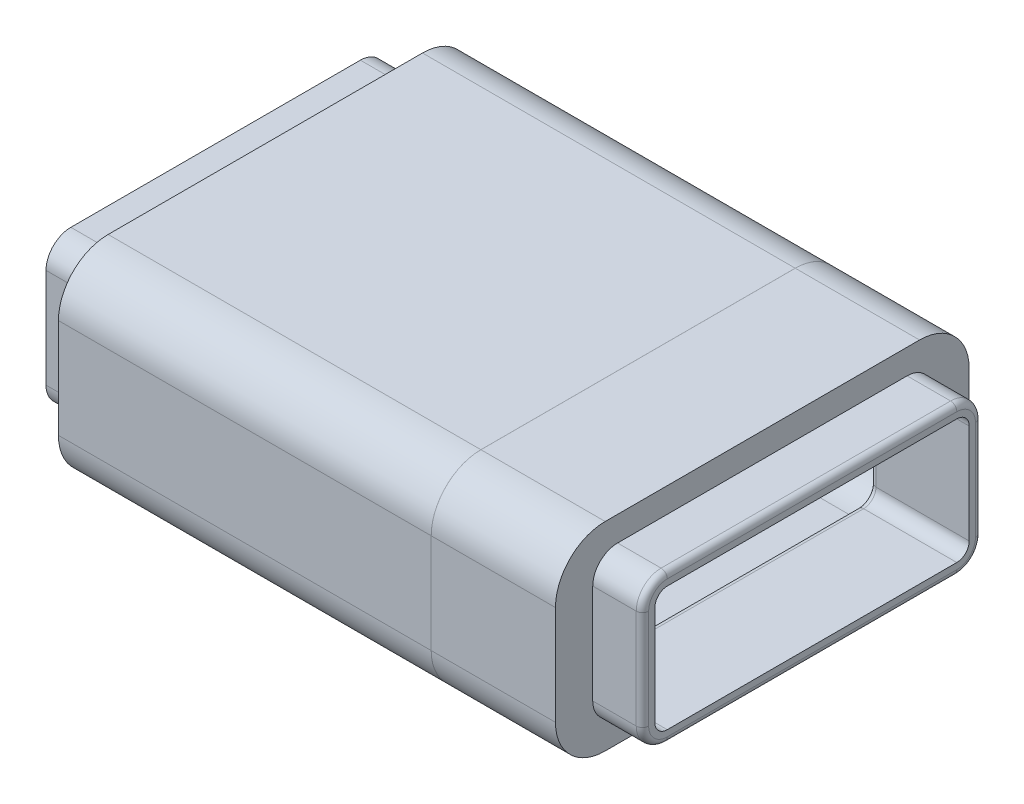
from build123d import *

# Parameters (mm, degrees)
BOSS_EXTRUDE1_DEPTH = 4
BOSS_EXTRUDE2_START = -4
BOSS_EXTRUDE2_DEPTH = 4
FILLET1_R           = 0.5
BOSS_EXTRUDE3_DEPTH = 4
BOSS_EXTRUDE5_DEPTH = 4
FILLET2_R           = 0.5


with BuildPart() as part:
    # Sweep1: sweep along a path in Sketch2path
    with BuildLine(Plane.XY) as sweep1_path:
        Line((40.002617842, -0.001745558), (30.002617994, -2.28e-07))
        ThreePointArc((30.002617994, -2.28e-07), (30.001308997, -5.7e-08), (30, 0))
        Line((30, 0), (0, 0))
    # Sketch3 → Sweep1 (sweep)
    with BuildSketch(Plane(origin=(0, 0, 0), x_dir=(0, 0, -1), z_dir=(1, 0, 0))):
        with BuildLine():
            Line((-16.65, -4), (-16.65, 4))
            ThreePointArc((-16.65, 4), (-15.478427125, 6.828427125), (-12.65, 8))
            Line((-12.65, 8), (12.65, 8))
            ThreePointArc((12.65, 8), (15.478427125, 6.828427125), (16.65, 4))
            Line((16.65, 4), (16.65, -4))
            ThreePointArc((16.65, -4), (15.478427125, -6.828427125), (12.65, -8))
            Line((12.65, -8), (-12.65, -8))
            ThreePointArc((-12.65, -8), (-15.478427125, -6.828427125), (-16.65, -4))
        make_face()
        with BuildLine():
            Line((-15.65, -4), (-15.65, 4))
            ThreePointArc((-15.65, 4), (-14.771320344, 6.121320344), (-12.65, 7))
            Line((-12.65, 7), (12.65, 7))
            ThreePointArc((12.65, 7), (14.771320344, 6.121320344), (15.65, 4))
            Line((15.65, 4), (15.65, -4))
            ThreePointArc((15.65, -4), (14.771320344, -6.121320344), (12.65, -7))
            Line((12.65, -7), (-12.65, -7))
            ThreePointArc((-12.65, -7), (-14.771320344, -6.121320344), (-15.65, -4))
        make_face(mode=Mode.SUBTRACT)
    sweep(path=sweep1_path.line)



with BuildPart() as body_2:
    # Sketch4 → Boss-Extrude1 (new, symmetric)
    with BuildSketch(Plane(origin=(40.002616928, -0.006981774, 0), x_dir=(0, 0, -1), z_dir=(0.9999999847691291, -0.00017453292431325135, 0))):
        with BuildLine():
            ThreePointArc((-11.65, 5.005236216), (-12.357106781, 4.712342997), (-12.65, 4.005236216))
            Line((-12.65, 4.005236216), (-12.65, 0))
            Line((-12.65, 0), (-13.65, 0))
            Line((-13.65, 0), (-13.65, 4.005236216))
            ThreePointArc((-13.65, 4.005236216), (-13.064213562, 5.419449779), (-11.65, 6.005236216))
            Line((-11.65, 6.005236216), (0, 6.005236216))
            Line((0, 6.005236216), (0, 5.005236216))
            Line((0, 5.005236216), (-11.65, 5.005236216))
        make_face()
    extrude(amount=BOSS_EXTRUDE1_DEPTH, both=True)

    # Mirror1: body 2 across plane


with BuildPart() as body_2_1:
    add(body_2.part)
    add(body_2.part.mirror(Plane.XY))

    # Mirror2: body 2 across plane


with BuildPart() as body_2_2:
    add(body_2_1.part)
    add(body_2_1.part.mirror(Plane(origin=(44.002616867, -0.007679906, 0), x_dir=(0, 0, 1), z_dir=(0.00017453292431325135, 0.9999999847691291, 0))))


with BuildPart() as part_1:
    add(part.part)

    add(body_2_2.part)  # Boss-Extrude2 merges body 2
    # Sketch5 → Boss-Extrude2 (add)
    with BuildSketch(Plane(origin=(40.002616928, -0.006981774, 0), x_dir=(0, 0, -1), z_dir=(0.9999999847691291, -0.00017453292431325135, 0)).offset(BOSS_EXTRUDE2_START)):
        with BuildLine():
            Line((-15.65, 4.005236216), (-15.65, -3.994763784))
            ThreePointArc((-15.65, -3.994763784), (-14.771320344, -6.116084127), (-12.65, -6.994763784))
            Line((-12.65, -6.994763784), (12.65, -6.994763784))
            ThreePointArc((12.65, -6.994763784), (14.771320344, -6.116084127), (15.65, -3.994763784))
            Line((15.65, -3.994763784), (15.65, 4.005236216))
            ThreePointArc((15.65, 4.005236216), (14.771320344, 6.12655656), (12.65, 7.005236216))
            Line((12.65, 7.005236216), (-12.65, 7.005236216))
            ThreePointArc((-12.65, 7.005236216), (-14.771320344, 6.12655656), (-15.65, 4.005236216))
        make_face()
        with BuildLine():
            Line((-13.65, 4.005239721), (-13.65, -4.005239721))
            ThreePointArc((-13.65, -4.005239721), (-13.064212323, -5.419451018), (-11.65, -6.005236216))
            Line((-11.65, -6.005236216), (11.65, -6.005236216))
            ThreePointArc((11.65, -6.005236216), (13.064212323, -5.419451018), (13.65, -4.005239721))
            Line((13.65, -4.005239721), (13.65, 4.005239721))
            ThreePointArc((13.65, 4.005239721), (13.064212323, 5.419451018), (11.65, 6.005236216))
            Line((11.65, 6.005236216), (-11.65, 6.005236216))
            ThreePointArc((-11.65, 6.005236216), (-13.064212323, 5.419451018), (-13.65, 4.005239721))
        make_face(mode=Mode.SUBTRACT)
    extrude(amount=BOSS_EXTRUDE2_DEPTH)

    # Fillet1
    fillet1_edges = [part_1.edges().sort_by_distance(p)[0] for p in [
        (36.003686274, 6.120272824, 14.771320344),
        (36.003839633, 6.998952467, 0),
        (36.003686274, 6.120272824, -14.771320344),
        (36.002617902, -0.001047426, -15.65),
        (36.001549531, -6.122367676, -14.771320344),
        (36.001396172, -7.001047319, 0),
        (36.001549531, -6.122367676, 14.771320344),
        (36.002617902, -0.001047426, 15.65),
        (44.002616867, -0.007679906, 13.65),
        (44.001670994, -5.427129602, -13.064213562),
        (44.003664978, 5.997556219, 0),
        (44.003562739, 5.411769791, 13.064213562),
        (36.002616989, -0.006283642, 12.65),
        (36.00179453, -4.718626568, -12.357106781),
        (36.003490567, 4.998952498, 0),
        (36.003439448, 4.706059283, 12.357106781),
        (36.003439448, 4.706059283, -12.357106781),
        (44.003562739, 5.411769791, -13.064213562),
        (44.002616867, -0.007679906, -13.65),
        (36.002616989, -0.006283642, -12.65),
        (36.00179453, -4.718626568, 12.357106781),
        (36.00174341, -5.011519782, 0),
        (44.001568755, -6.01291603, 0),
        (44.001670994, -5.427129602, 13.064213562),
    ]]
    fillet(fillet1_edges, radius=FILLET1_R)



with BuildPart() as body_2_2_1:
    # Sketch6 → Boss-Extrude3 (new, symmetric)
    with BuildSketch(Plane.ZY):
        with BuildLine():
            Line((0, 5.999039734), (-11.65, 5.999039734))
            ThreePointArc((-11.65, 5.999039734), (-13.064213553, 5.413253319), (-13.65, 3.99903978))
            Line((-13.65, 3.99903978), (-13.65, 0))
            Line((-13.65, 0), (-12.65, 0))
            Line((-12.65, 0), (-12.65, 3.99903978))
            ThreePointArc((-12.65, 3.99903978), (-12.357106772, 4.706146538), (-11.65, 4.999039734))
            Line((-11.65, 4.999039734), (0, 4.999039734))
            Line((0, 4.999039734), (0, 5.999039734))
        make_face()
    extrude(amount=BOSS_EXTRUDE3_DEPTH, both=True)

    # Mirror3: body 2 2 across plane


with BuildPart() as body_2_2_2:
    add(body_2_2_1.part)
    add(body_2_2_1.part.mirror(Plane.XY))

    # Mirror4: body 2 2 across plane


with BuildPart() as body_2_2_3:
    add(body_2_2_2.part)
    add(body_2_2_2.part.mirror(Plane(origin=(-4, 0, 0), x_dir=(0, 0, 1), z_dir=(0, 1, 0))))


with BuildPart() as part_2:
    add(part_1.part)

    add(body_2_2_3.part)  # Boss-Extrude5 merges body 2 2
    # Sketch7 → Boss-Extrude5 (add)
    with BuildSketch(Plane.ZY):
        with BuildLine():
            Line((15.65, -4), (15.65, 4))
            ThreePointArc((15.65, 4), (14.771320344, 6.121320344), (12.65, 7))
            Line((12.65, 7), (-12.65, 7))
            ThreePointArc((-12.65, 7), (-14.771320344, 6.121320344), (-15.65, 4))
            Line((-15.65, 4), (-15.65, -4))
            ThreePointArc((-15.65, -4), (-14.771320344, -6.121320344), (-12.65, -7))
            Line((-12.65, -7), (12.65, -7))
            ThreePointArc((12.65, -7), (14.771320344, -6.121320344), (15.65, -4))
        make_face()
        with BuildLine():
            ThreePointArc((-11.65, -5.999039734), (-13.064213553, -5.413253319), (-13.65, -3.99903978))
            Line((-13.65, -3.99903978), (-13.65, 3.99903978))
            ThreePointArc((-13.65, 3.99903978), (-13.064213553, 5.413253319), (-11.65, 5.999039734))
            Line((-11.65, 5.999039734), (11.65, 5.999039734))
            ThreePointArc((11.65, 5.999039734), (13.064213553, 5.413253319), (13.65, 3.99903978))
            Line((13.65, 3.99903978), (13.65, -3.99903978))
            ThreePointArc((13.65, -3.99903978), (13.064213553, -5.413253319), (11.65, -5.999039734))
            Line((11.65, -5.999039734), (-11.65, -5.999039734))
        make_face(mode=Mode.SUBTRACT)
    extrude(amount=-BOSS_EXTRUDE5_DEPTH)

    # Fillet2
    fillet2_edges = [part_2.edges().sort_by_distance(p)[0] for p in [
        (4, 6.121320344, 14.771320344),
        (4, 0, 15.65),
        (4, -6.121320344, 14.771320344),
        (4, -7, 0),
        (4, -6.121320344, -14.771320344),
        (4, 0, -15.65),
        (4, 6.121320344, -14.771320344),
        (4, 7, 0),
        (-4, 0, -12.65),
        (-4, 4.706146538, -12.357106772),
        (-4, 4.999039734, 0),
        (-4, -4.706146538, -12.357106772),
        (-4, 4.706146538, 12.357106772),
        (-4, 0, 12.65),
        (-4, -4.999039734, 0),
        (4, 0, -12.65),
        (4, -4.706146538, 12.357106772),
        (4, 4.999039734, 0),
        (4, 4.706146538, -12.357106772),
        (4, 0, 12.65),
        (4, 4.706146538, 12.357106772),
        (4, -4.706146538, -12.357106772),
        (4, -4.999039734, 0),
        (-4, -4.706146538, 12.357106772),
    ]]
    fillet(fillet2_edges, radius=FILLET2_R)


solid = part_2.part
